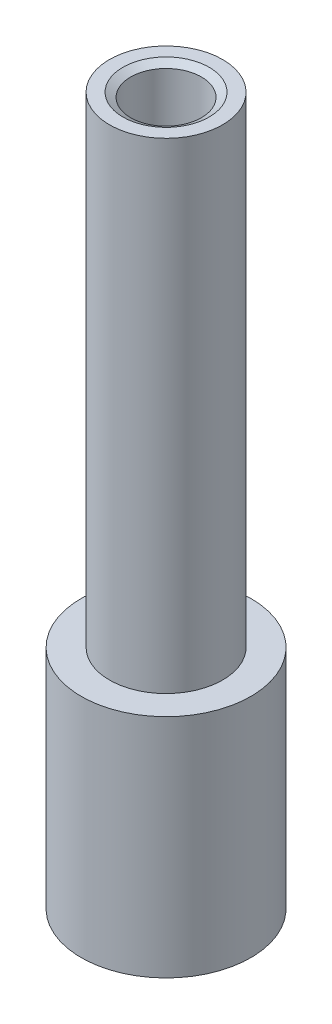
from build123d import *

# Parameters (mm, degrees)
HOLE_WIZARD_M32_D           = 2.5
HOLE_WIZARD_M32_DEPTH       = 8.5
HOLE_WIZARD_M32_CSINK_D     = 3.05
HOLE_WIZARD_M32_CSINK_ANGLE = 120
HOLE_WIZARD_M32_TIP         = 0.751075774
HOLE_WIZARD_1_D             = 3.3
HOLE_WIZARD_1_DEPTH         = 6
HOLE_WIZARD_1_CSINK_D       = 4.05
HOLE_WIZARD_1_CSINK_ANGLE   = 120
HOLE_WIZARD_1_TIP           = 0.991420021


with BuildPart() as part:
    # Эскиз2 → Повернуть1 (revolve)
    with BuildSketch(Plane(origin=(0, 0, 0), x_dir=(0, 0, -1), z_dir=(1, 0, 0))):
        Polygon((0, 0), (2, 0), (2, 0.01), (3, 0.01), (3, 8.01), (2, 8.01), (2, 25.01), (0, 25.01), align=None)
    revolve(axis=Axis((0, 0, 0), (0, 1, 0)))

    # Отверстие обработанное метчиком M32
    with Locations(Plane(origin=(0, 25.01, 0), x_dir=(-1, 0, 0), z_dir=(0, 1, 0))):
        with Locations((0, 0)):
            CounterSinkHole(HOLE_WIZARD_M32_D / 2, HOLE_WIZARD_M32_CSINK_D / 2, depth=HOLE_WIZARD_M32_DEPTH, counter_sink_angle=HOLE_WIZARD_M32_CSINK_ANGLE)
            with Locations((0, 0, -(HOLE_WIZARD_M32_DEPTH + HOLE_WIZARD_M32_TIP / 2))):  # 118° drill point
                Cone(0, HOLE_WIZARD_M32_D / 2, HOLE_WIZARD_M32_TIP, mode=Mode.SUBTRACT)

    # Отверстие обработанное метчиком 1
    with Locations(Plane.XZ):
        with Locations((0, 0)):
            CounterSinkHole(HOLE_WIZARD_1_D / 2, HOLE_WIZARD_1_CSINK_D / 2, depth=HOLE_WIZARD_1_DEPTH, counter_sink_angle=HOLE_WIZARD_1_CSINK_ANGLE)
            with Locations((0, 0, -(HOLE_WIZARD_1_DEPTH + HOLE_WIZARD_1_TIP / 2))):  # 118° drill point
                Cone(0, HOLE_WIZARD_1_D / 2, HOLE_WIZARD_1_TIP, mode=Mode.SUBTRACT)


solid = part.part
